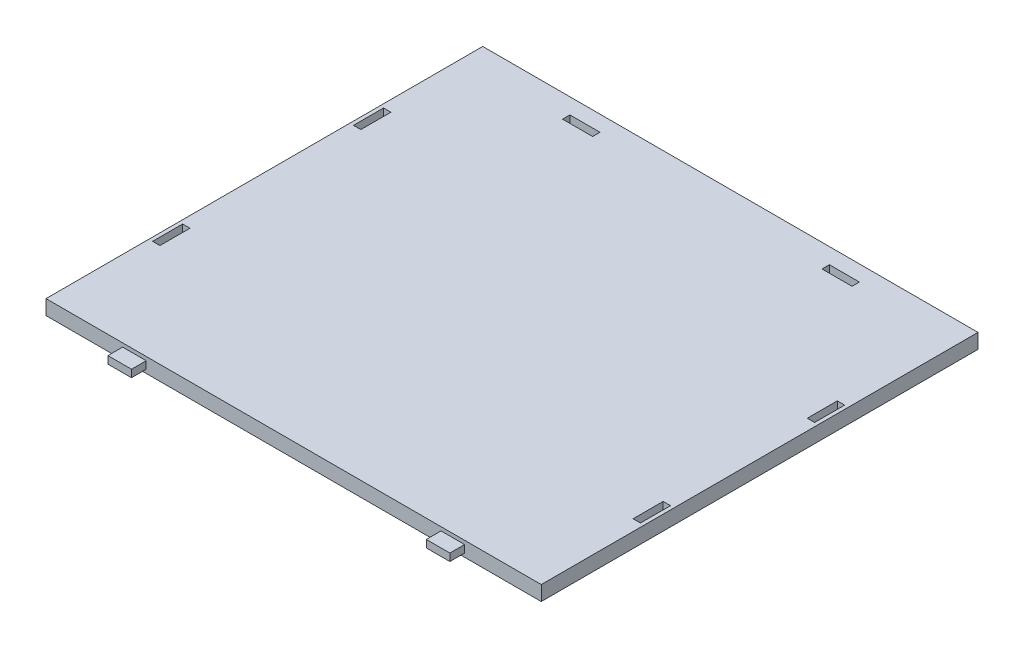
from build123d import *

# Parameters (mm, degrees)
CROQUIS1_W              = 168
CROQUIS1_H              = 148.15
SALIENTE_EXTRUIR1_DEPTH = 5
CROQUIS2_W              = 2.5
CROQUIS2_H              = 10.2
CORTAR_EXTRUIR1_DEPTH   = 5
CROQUIS4_W              = 8
CROQUIS4_H              = 2.5
SALIENTE_EXTRUIR2_DEPTH = 5
SKETCH1_W               = 10.2
SKETCH1_H               = 2.5
CUT_EXTRUDE2_DEPTH      = 5


with BuildPart() as part:
    # Croquis1 → Saliente-Extruir1 (new body)
    with BuildSketch(Plane(origin=(0, 0, 0), x_dir=(1, 0, 0), z_dir=(0, 1, 0))):
        Rectangle(CROQUIS1_W, CROQUIS1_H)
    extrude(amount=SALIENTE_EXTRUIR1_DEPTH)

    # Croquis2 → Cortar-Extruir1 (cut)
    with BuildSketch(Plane(origin=(0, 5, 0), x_dir=(1, 0, 0), z_dir=(0, 1, 0))):
        with Locations((-81.5, 34.075)):
            Rectangle(CROQUIS2_W, CROQUIS2_H)
        with Locations((-81.5, -34.075)):
            Rectangle(CROQUIS2_W, CROQUIS2_H)
        with Locations((81.5, -34.075)):
            Rectangle(CROQUIS2_W, CROQUIS2_H)
        with Locations((81.5, 25)):
            Rectangle(CROQUIS2_W, CROQUIS2_H)
    extrude(amount=-CORTAR_EXTRUIR1_DEPTH, mode=Mode.SUBTRACT)

    # Croquis4 → Saliente-Extruir2 (add)
    with BuildSketch(Plane.XY.offset(74.075)):
        with Locations((-54, 2.5)):
            Rectangle(CROQUIS4_W, CROQUIS4_H)
        with Locations((54, 2.5)):
            Rectangle(CROQUIS4_W, CROQUIS4_H)
    extrude(amount=SALIENTE_EXTRUIR2_DEPTH)

    # Sketch1 → Cut-Extrude2 (cut)
    with BuildSketch(Plane(origin=(0, 5, 0), x_dir=(1, 0, 0), z_dir=(0, 1, 0))):
        with Locations((-44, 67.49891)):
            Rectangle(SKETCH1_W, SKETCH1_H)
        with Locations((44, 67.49891)):
            Rectangle(SKETCH1_W, SKETCH1_H)
    extrude(amount=-CUT_EXTRUDE2_DEPTH, mode=Mode.SUBTRACT)


solid = part.part
